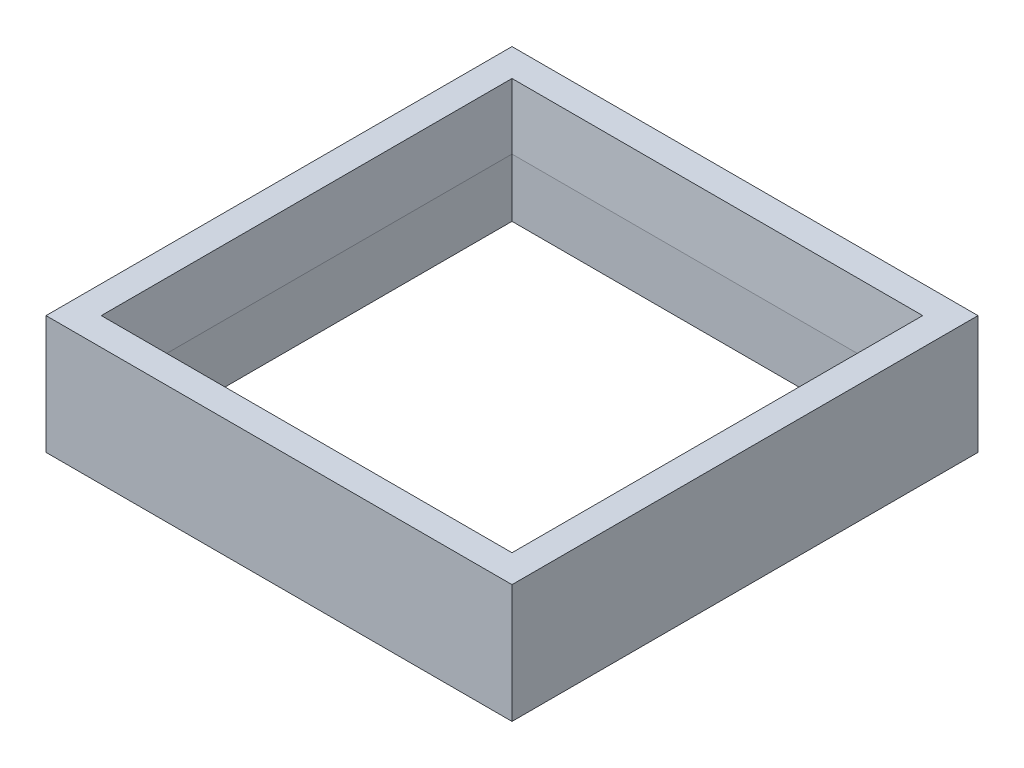
from build123d import *

# Parameters (mm, degrees)
SKETCH1_W           = 44.958
SKETCH1_H           = 44.958
SKETCH1_W_2         = 38.608
SKETCH1_H_2         = 38.608
BOSS_EXTRUDE1_DEPTH = 11.43
CHAMFER1_SIZE       = 0.508
CHAMFER1_SIZE2      = 5.80646657


with BuildPart() as part:
    # Sketch1 → Boss-Extrude1 (new body)
    with BuildSketch(Plane(origin=(0, 0, 0), x_dir=(1, 0, 0), z_dir=(0, 1, 0))):
        Rectangle(SKETCH1_W, SKETCH1_H)
        Rectangle(SKETCH1_W_2, SKETCH1_H_2, mode=Mode.SUBTRACT)
    extrude(amount=BOSS_EXTRUDE1_DEPTH)

    # Chamfer1
    chamfer1_edges = [part.edges().sort_by_distance(p)[0] for p in [
        (19.304, 11.43, 0),
        (0, 11.43, -19.304),
        (-19.304, 11.43, 0),
        (0, 11.43, 19.304),
    ]]
    chamfer1_side = [part.faces().sort_by_distance(p)[0] for p in [
        (0, 11.43, 21.843197867),
    ]]
    chamfer(chamfer1_edges, length=CHAMFER1_SIZE, length2=CHAMFER1_SIZE2, reference=chamfer1_side[0])


solid = part.part
